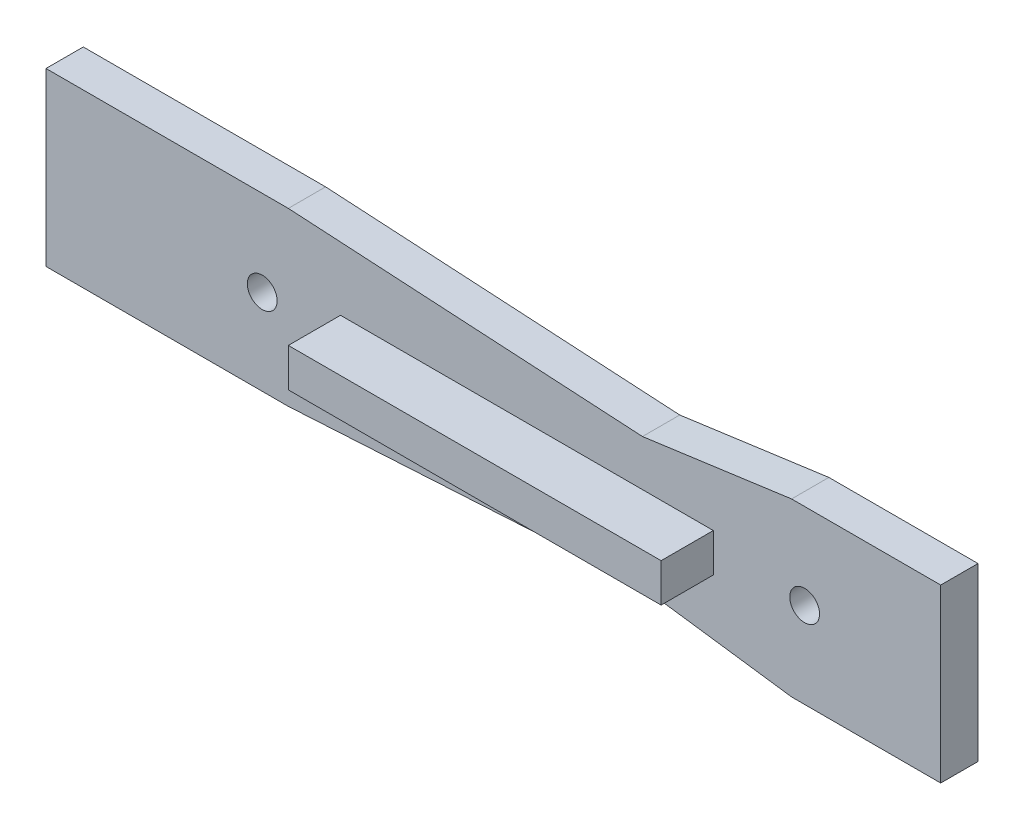
from build123d import *

# Parameters (mm, degrees)
SKETCH_1_W          = 240
SKETCH_1_H          = 46
EXTRUDE_1_DEPTH     = 10
CUT_EXTRUDE_1_DEPTH = 10
SKETCH_3_W          = 66.746798051
SKETCH_3_H          = 10
EXTRUDE_3_DEPTH     = 14
SKETCH_5_R          = 12.5
CUT_EXTRUDE_2_DEPTH = 14
SKETCH_6_R          = 4
CUT_EXTRUDE_3_DEPTH = 10
SKETCH_7_W          = 66.746798051
SKETCH_7_H          = 14
CUT_EXTRUDE_4_DEPTH = 10
SKETCH_8_W          = 100
SKETCH_8_H          = 10.327994094
EXTRUDE_4_DEPTH     = 14
SKETCH_9_R          = 12.5
SKETCH_9_R_2        = 4
EXTRUDE_5_DEPTH     = 10


with BuildPart() as part:
    # 草图1 → 凸台-拉伸1 (new body)
    with BuildSketch(Plane.XY):
        Rectangle(SKETCH_1_W, SKETCH_1_H)
    extrude(amount=EXTRUDE_1_DEPTH)

    # 草图2 → 切除-拉伸1 (cut)
    with BuildSketch(Plane.XY.offset(10)):
        Polygon((-55, 23), (-20.454545455, 21), (40, 21), (40, 17.5), (80, 23), align=None)
        Polygon((80, -23), (40, -17.5), (40, -21), (-20.454545455, -21), (-55, -23), align=None)
        Polygon((40, -21), (40, -17.5), (-20.454545455, -21), align=None)
        Polygon((40, 21), (-20.454545455, 21), (40, 17.5), align=None)
    extrude(amount=-CUT_EXTRUDE_1_DEPTH, mode=Mode.SUBTRACT)

    # 草图3 → 凸台-拉伸3 (add)
    with BuildSketch(Plane.XY.offset(10)):
        with Locations((-11.626600974, 0)):
            Rectangle(SKETCH_3_W, SKETCH_3_H)
    extrude(amount=EXTRUDE_3_DEPTH)

    # 草图5 → 切除-拉伸2 (cut)
    with BuildSketch(Plane.XY.offset(10)):
        with Locations((83.5, 0)):
            Circle(SKETCH_5_R)
    extrude(amount=-CUT_EXTRUDE_2_DEPTH, mode=Mode.SUBTRACT)

    # 草图6 → 切除-拉伸3 (cut)
    with BuildSketch(Plane.XY.offset(10)):
        with Locations((-62, 0)):
            Circle(SKETCH_6_R)
    extrude(amount=-CUT_EXTRUDE_3_DEPTH, mode=Mode.SUBTRACT)

    # 草图7 → 切除-拉伸4 (cut)
    with BuildSketch(Plane.XZ.offset(5)):
        with Locations((-11.626600974, 17)):
            Rectangle(SKETCH_7_W, SKETCH_7_H)
    extrude(amount=-CUT_EXTRUDE_4_DEPTH, mode=Mode.SUBTRACT)

    # 草图8 → 凸台-拉伸4 (add)
    with BuildSketch(Plane.XY.offset(10)):
        with Locations((9, 0)):
            Rectangle(SKETCH_8_W, SKETCH_8_H)
    extrude(amount=EXTRUDE_4_DEPTH)

    # 草图9 → 凸台-拉伸5 (add)
    with BuildSketch(Plane.XY.offset(10)):
        with Locations((83.5, 0)):
            Circle(SKETCH_9_R)
        with Locations((83.5, 0)):
            Circle(SKETCH_9_R_2, mode=Mode.SUBTRACT)
    extrude(amount=-EXTRUDE_5_DEPTH)


solid = part.part
